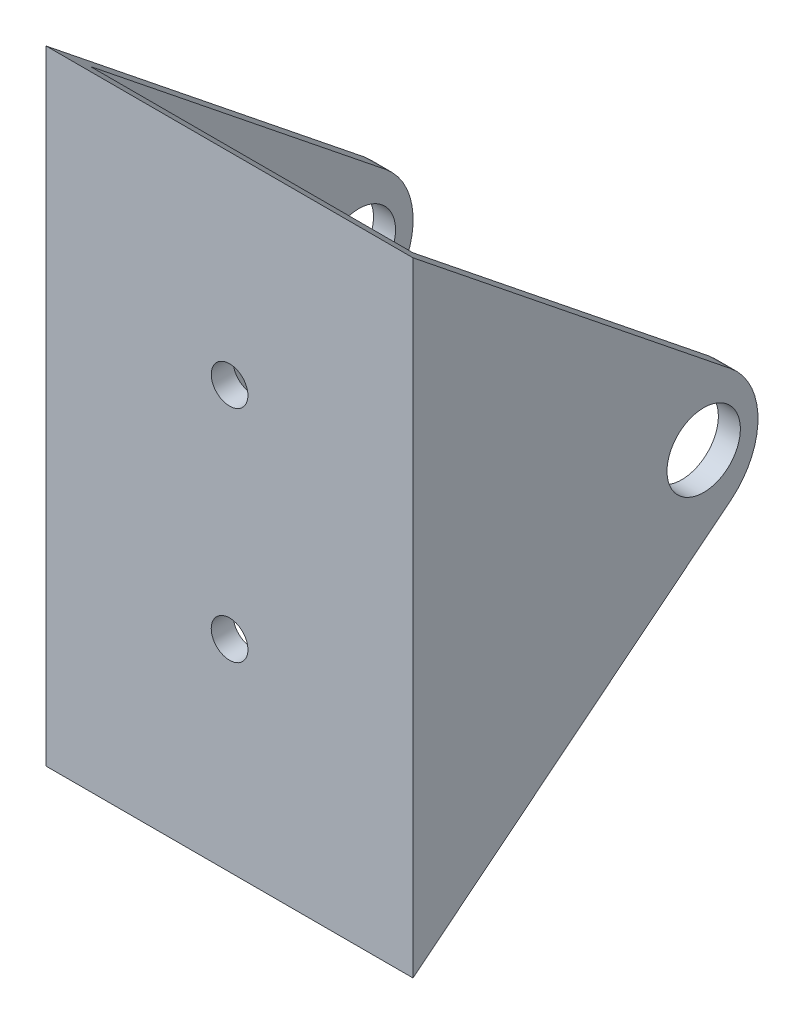
from build123d import *

# Parameters (mm, degrees)
SKETCH1_W           = 50
SKETCH1_H           = 85
BOSS_EXTRUDE1_DEPTH = 3
SKETCH4_W           = 3
SKETCH4_H           = 85
BOSS_EXTRUDE2_DEPTH = 50
CUT_EXTRUDE1_DEPTH  = 50
FILLET2_R           = 10
SKETCH6_R           = 5
CUT_EXTRUDE2_DEPTH  = 50
SKETCH7_R           = 2.5
CUT_EXTRUDE3_DEPTH  = 20


with BuildPart() as part:
    # Sketch1 → Boss-Extrude1 (new body)
    with BuildSketch(Plane.XY):
        Rectangle(SKETCH1_W, SKETCH1_H)
    extrude(amount=BOSS_EXTRUDE1_DEPTH)

    # Sketch4 → Boss-Extrude2 (add)
    with BuildSketch(Plane(origin=(0, 0, 0), x_dir=(-1, 0, 0), z_dir=(0, 0, -1))):
        with Locations((-23.5, 0)):
            Rectangle(SKETCH4_W, SKETCH4_H)
        with Locations((23.5, 0)):
            Rectangle(SKETCH4_W, SKETCH4_H)
    extrude(amount=BOSS_EXTRUDE2_DEPTH)

    # Sketch5 → Cut-Extrude1 (cut)
    with BuildSketch(Plane(origin=(25, 0, 0), x_dir=(0, 0, -1), z_dir=(1, 0, 0))):
        Polygon((50, 0), (-3, -42.5), (50, -42.5), align=None)
        Polygon((-3, 42.5), (50, 0), (50, 42.5), align=None)
    extrude(amount=-CUT_EXTRUDE1_DEPTH, mode=Mode.SUBTRACT)

    # Fillet2
    fillet2_edges = [part.edges().sort_by_distance(p)[0] for p in [
        (23.5, 0, -50),
        (-23.5, 0, -50),
    ]]
    fillet(fillet2_edges, radius=FILLET2_R)

    # Sketch6 → Cut-Extrude2 (cut)
    with BuildSketch(Plane(origin=(25, 0, 0), x_dir=(0, 0, -1), z_dir=(1, 0, 0))):
        with Locations(Location((36.614754057, 0, 0), (0, 0, 90))):
            Circle(SKETCH6_R)
    extrude(amount=-CUT_EXTRUDE2_DEPTH, mode=Mode.SUBTRACT)

    # Sketch7 → Cut-Extrude3 (cut)
    with BuildSketch(Plane.XY.offset(3)):
        with Locations((0, 15)):
            Circle(SKETCH7_R)
        with Locations((0, -15)):
            Circle(SKETCH7_R)
    extrude(amount=-CUT_EXTRUDE3_DEPTH, mode=Mode.SUBTRACT)


solid = part.part
